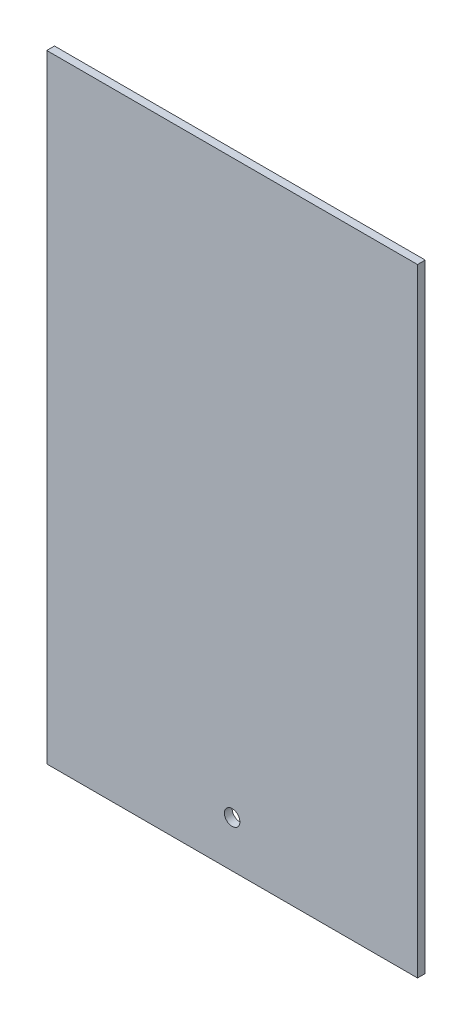
from build123d import *

# Parameters (mm, degrees)
SKETCH1_W           = 152.4
SKETCH1_H           = 254
BOSS_EXTRUDE1_DEPTH = 3.175
SKETCH2_R           = 3.175
CUT_EXTRUDE1_DEPTH  = 149.140205971


with BuildPart() as part:
    # Sketch1 → Boss-Extrude1 (new body)
    with BuildSketch(Plane.XY):
        Rectangle(SKETCH1_W, SKETCH1_H)
    extrude(amount=BOSS_EXTRUDE1_DEPTH)

    # Sketch2 → Cut-Extrude1 (cut, through all)
    with BuildSketch(Plane.XY.offset(3.175)):
        with Locations((0, -107.95)):
            Circle(SKETCH2_R)
    extrude(amount=-CUT_EXTRUDE1_DEPTH, mode=Mode.SUBTRACT)


solid = part.part
